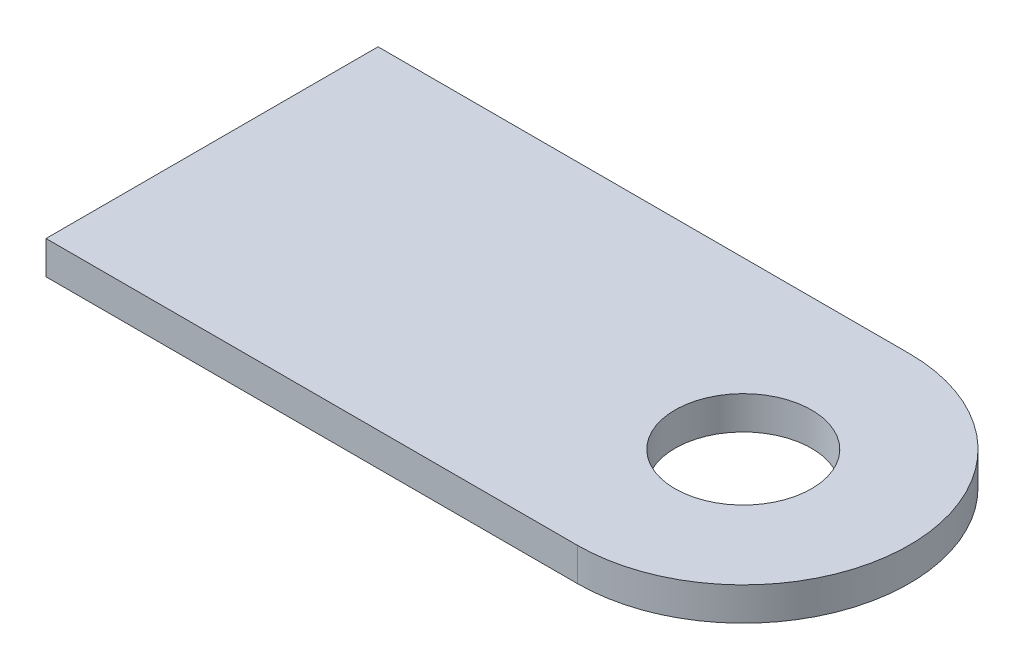
from build123d import *

# Parameters (mm, degrees)
SKETCH1_R           = 3.2639
BOSS_EXTRUDE1_DEPTH = 1.5875


with BuildPart() as part:
    # Sketch1 → Boss-Extrude1 (new body)
    with BuildSketch(Plane(origin=(0, 0, 0), x_dir=(1, 0, 0), z_dir=(0, 1, 0))):
        with BuildLine():
            Line((-25.4, 7.9375), (0, 7.9375))
            ThreePointArc((0, 7.9375), (7.9375, 0), (0, -7.9375))
            Line((0, -7.9375), (-25.4, -7.9375))
            Line((-25.4, -7.9375), (-25.4, 7.9375))
        make_face()
        with Locations(Location((0, 0, 0), (0, 0, 270))):
            Circle(SKETCH1_R, mode=Mode.SUBTRACT)
    extrude(amount=BOSS_EXTRUDE1_DEPTH)


solid = part.part
